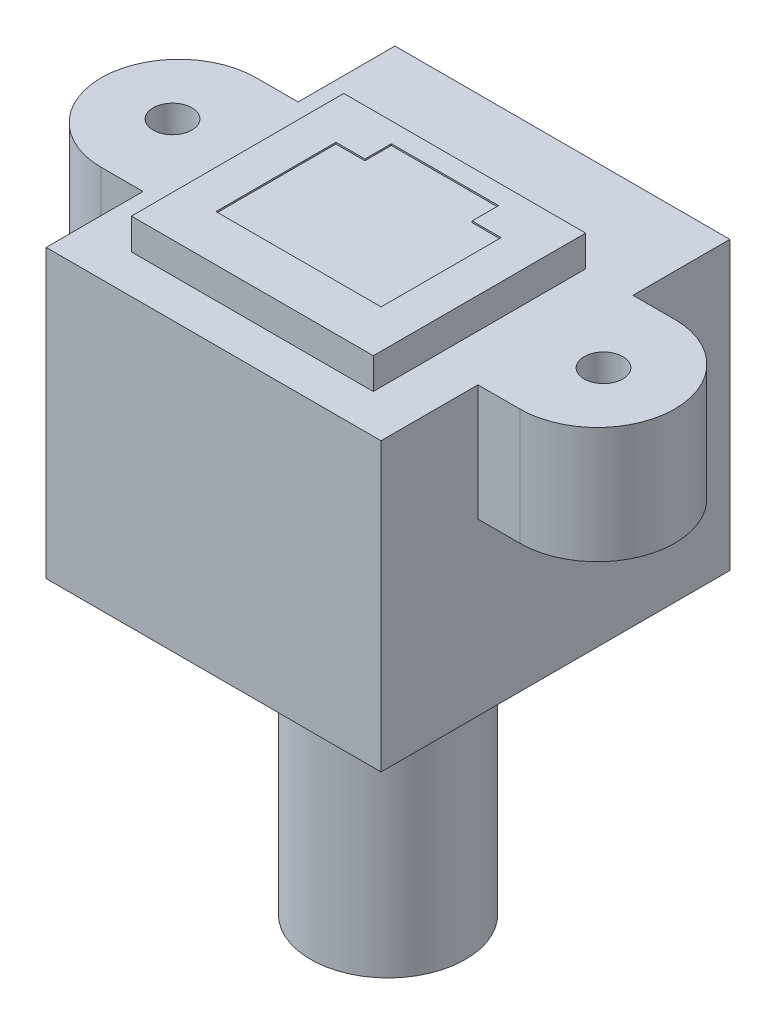
from build123d import *

# Parameters (mm, degrees)
SKETCH_1_W          = 15.6
SKETCH_1_H          = 13.7
EXTRUDE_1_DEPTH     = 2
EXTRUDE_2_DEPTH     = 7.5
SKETCH_4_W          = 21.6
SKETCH_4_H          = 22.5
EXTRUDE_3_DEPTH     = 15
CHAMFER_1_SIZE      = 4
SKETCH_5_R          = 5
EXTRUDE_4_DEPTH     = 15
CUT_EXTRUDE_1_DEPTH = 0.1
HOLE_WIZARD_M3_1_D  = 2.5


with BuildPart() as part:
    # 草图1 → 凸台-拉伸1 (new body)
    with BuildSketch(Plane(origin=(0, 0, 0), x_dir=(1, 0, 0), z_dir=(0, 1, 0))):
        Rectangle(SKETCH_1_W, SKETCH_1_H)
    extrude(amount=EXTRUDE_1_DEPTH)

    # 草图3 → 凸台-拉伸2 (add)
    with BuildSketch(Plane.XZ):
        with BuildLine():
            Line((-10.8, 9.35), (10.8, 9.35))
            Line((10.8, 9.35), (10.8, 3.1))
            Line((10.8, 3.1), (13.5, 3.1))
            ThreePointArc((13.5, 3.1), (18.5, -1.9), (13.5, -6.9))
            Line((13.5, -6.9), (10.8, -6.9))
            Line((10.8, -6.9), (10.8, -13.15))
            Line((10.8, -13.15), (-10.8, -13.15))
            Line((-10.8, -13.15), (-10.8, -6.9))
            Line((-10.8, -6.9), (-13.5, -6.9))
            ThreePointArc((-13.5, -6.9), (-18.5, -1.9), (-13.5, 3.1))
            Line((-13.5, 3.1), (-10.8, 3.1))
            Line((-10.8, 3.1), (-10.8, 9.35))
        make_face()
    extrude(amount=EXTRUDE_2_DEPTH)

    # 草图4 → 凸台-拉伸3 (add)
    with BuildSketch(Plane.XZ.offset(7.5)):
        with Locations((0, -1.9)):
            Rectangle(SKETCH_4_W, SKETCH_4_H)
    extrude(amount=EXTRUDE_3_DEPTH)

    # 倒角1
    chamfer_1_edges = [part.edges().sort_by_distance(p)[0] for p in [
        (-10.8, -22.5, -1.9),
        (0, -22.5, -13.15),
        (10.8, -22.5, -1.9),
        (0, -22.5, 9.35),
    ]]
    chamfer(chamfer_1_edges, length=CHAMFER_1_SIZE)

    # 草图5 → 凸台-拉伸4 (add)
    with BuildSketch(Plane.XZ.offset(22.5)):
        with Locations(Location((0, -1.9, 0), (0, 0, 270))):
            Circle(SKETCH_5_R)
    extrude(amount=EXTRUDE_4_DEPTH)

    # 草图6 → 切除-拉伸1 (cut)
    with BuildSketch(Plane(origin=(0, 2, 0), x_dir=(1, 0, 0), z_dir=(0, 1, 0))):
        Polygon((5.326744566, -3.869583795), (-5.326744566, -3.869583795), (-5.326744566, 3.869583795), (-3.458685709, 3.869583795), (-3.458685709, 5.575202752), (3.458685709, 5.575202752), (3.458685709, 3.869583795), (5.326744566, 3.869583795), align=None)
    extrude(amount=-CUT_EXTRUDE_1_DEPTH, mode=Mode.SUBTRACT)

    # M3 螺纹孔1 (through all)
    with Locations(Plane(origin=(0, 0, 0), x_dir=(1, 0, 0), z_dir=(0, 1, 0))):
        with Locations((13.9, 1.9), (-13.9, 1.9)):
            Hole(HOLE_WIZARD_M3_1_D / 2)


solid = part.part
